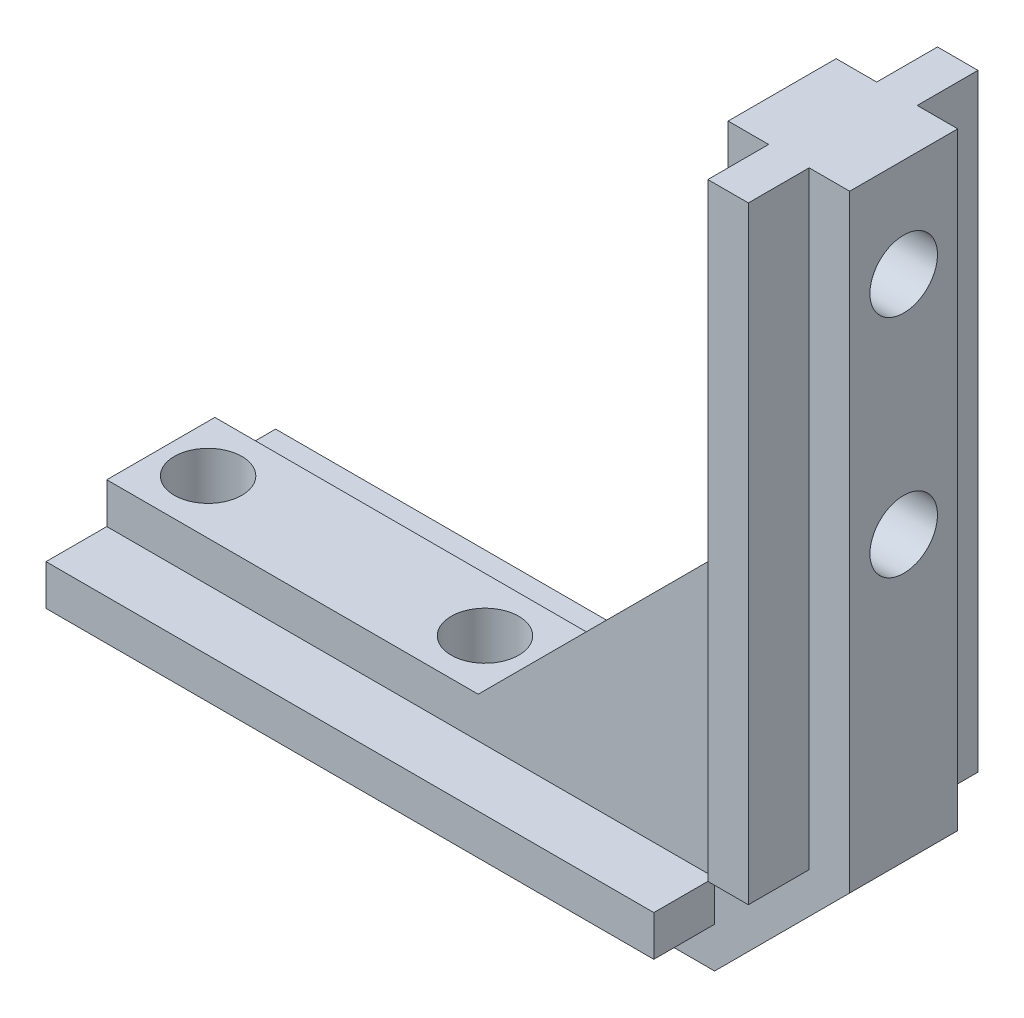
from build123d import *

# Parameters (mm, degrees)
BOSS_EXTRUDE1_DEPTH         = 4
SKETCH3_W                   = 45
SKETCH3_H                   = 3
SKETCH3_W_2                 = 3
SKETCH3_H_2                 = 45
BOSS_EXTRUDE2_DEPTH         = 4.5
BOSS_EXTRUDE3_START         = -8
SKETCH3_2_W                 = 45
SKETCH3_2_H                 = 3
SKETCH3_2_W_2               = 3
SKETCH3_2_H_2               = 45
BOSS_EXTRUDE3_DEPTH         = 4.5
TAP_DRILL_FOR_M6X1_0_TAP1_D = 5
TAP_DRILL_FOR_M6X1_0_TAP2_D = 5


with BuildPart() as part:
    # Sketch2 → Boss-Extrude1 (new, symmetric)
    with BuildSketch(Plane.XY):
        Polygon((0, 0), (45, 0), (55, 10), (55, 55), (46, 55), (46, 27.5), (27.5, 9), (0, 9), align=None)
    extrude(amount=BOSS_EXTRUDE1_DEPTH, both=True)

    # Sketch3 → Boss-Extrude2 (add)
    with BuildSketch(Plane.XY.offset(4)):
        with Locations((22.5, 4.5)):
            Rectangle(SKETCH3_W, SKETCH3_H)
        with Locations((50.5, 32.5)):
            Rectangle(SKETCH3_W_2, SKETCH3_H_2)
    extrude(amount=BOSS_EXTRUDE2_DEPTH)

    # Sketch3<2> → Boss-Extrude3 (add)
    with BuildSketch(Plane.XY.offset(4).offset(BOSS_EXTRUDE3_START)):
        with Locations((22.5, 4.5)):
            Rectangle(SKETCH3_2_W, SKETCH3_2_H)
        with Locations((50.5, 32.5)):
            Rectangle(SKETCH3_2_W_2, SKETCH3_2_H_2)
    extrude(amount=-BOSS_EXTRUDE3_DEPTH)

    # Tap Drill for M6x1.0 Tap1 (through all)
    with Locations(Plane.ZY.offset(-46)):
        with Locations((0, 31), (0, 47.69)):
            Hole(TAP_DRILL_FOR_M6X1_0_TAP1_D / 2)

    # Tap Drill for M6x1.0 Tap2 (through all)
    with Locations(Plane(origin=(0, 9, 0), x_dir=(1, 0, 0), z_dir=(0, 1, 0))):
        with Locations((24, 0), (3.5, 0)):
            Hole(TAP_DRILL_FOR_M6X1_0_TAP2_D / 2)


solid = part.part
